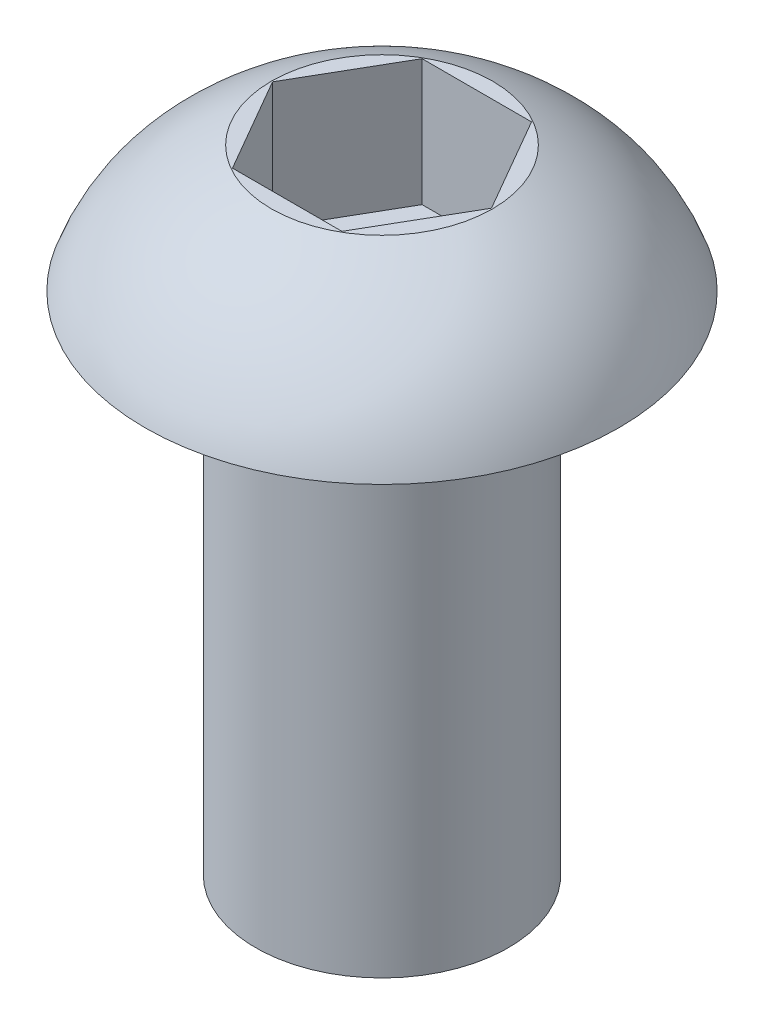
from build123d import *

# Parameters (mm, degrees)
SKETCH15_W           = 2
SKETCH15_H           = 8
SKETCH19_R           = 1.75
BOSS_EXTRUDE11_DEPTH = 2


with BuildPart() as part:
    # Sketch15 → Revolve3 (revolve)
    with BuildSketch(Plane(origin=(0, 0, 0), x_dir=(0, 0, -1), z_dir=(1, 0, 0))):
        Rectangle(SKETCH15_W, SKETCH15_H)
        with BuildLine():
            Line((0.75, 6), (0.75, 4))
            Line((0.75, 4), (1, 4))
            Line((1, 4), (2.75, 4))
            add(Edge.make_bspline(
                [(0.75, 6), (2.290975881, 5.319572534), (2.75, 4)],
                knots=[0, 0, 0, 0.856055689, 0.856055689, 0.856055689], degree=2))
        make_face()
    revolve(axis=Axis((0, -4, 1), (0, 1, 0)))

    # Sketch19 → Boss-Extrude11 (add)
    with BuildSketch(Plane(origin=(0, 4, 0), x_dir=(1, 0, 0), z_dir=(0, 1, 0))):
        with Locations((0, -1)):
            Circle(SKETCH19_R)
        Polygon((1.732050808, -1), (0.866025404, 0.5), (-0.866025404, 0.5), (-1.732050808, -1), (-0.866025404, -2.5), (0.866025404, -2.5), align=None, mode=Mode.SUBTRACT)
    extrude(amount=BOSS_EXTRUDE11_DEPTH)


solid = part.part
